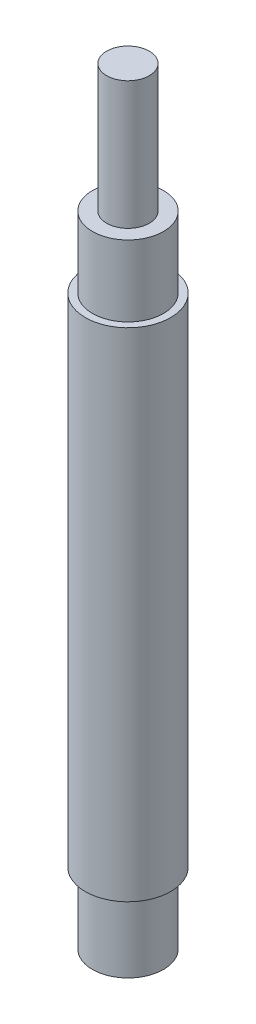
from build123d import *

# Parameters (mm, degrees)
SKETCH1_R           = 5
BOSS_EXTRUDE1_DEPTH = 10
SKETCH2_R           = 6
BOSS_EXTRUDE2_DEPTH = 70
SKETCH3_R           = 5
BOSS_EXTRUDE3_DEPTH = 10
SKETCH4_R           = 3
BOSS_EXTRUDE4_DEPTH = 18


with BuildPart() as part:
    # Sketch1 → Boss-Extrude1 (new body)
    with BuildSketch(Plane(origin=(0, 0, 0), x_dir=(1, 0, 0), z_dir=(0, 1, 0))):
        with Locations(Location((0, 0, 0), (0, 0, 270))):
            Circle(SKETCH1_R)
    extrude(amount=BOSS_EXTRUDE1_DEPTH)

    # Sketch2 → Boss-Extrude2 (add)
    with BuildSketch(Plane(origin=(0, 10, 0), x_dir=(1, 0, 0), z_dir=(0, 1, 0))):
        with Locations(Location((0, 0, 0), (0, 0, 270))):
            Circle(SKETCH2_R)
    extrude(amount=BOSS_EXTRUDE2_DEPTH)

    # Sketch3 → Boss-Extrude3 (add)
    with BuildSketch(Plane(origin=(0, 80, 0), x_dir=(1, 0, 0), z_dir=(0, 1, 0))):
        with Locations(Location((0, 0, 0), (0, 0, 270))):
            Circle(SKETCH3_R)
    extrude(amount=BOSS_EXTRUDE3_DEPTH)

    # Sketch4 → Boss-Extrude4 (add)
    with BuildSketch(Plane(origin=(0, 90, 0), x_dir=(1, 0, 0), z_dir=(0, 1, 0))):
        with Locations(Location((0, 0, 0), (0, 0, 270))):
            Circle(SKETCH4_R)
    extrude(amount=BOSS_EXTRUDE4_DEPTH)


solid = part.part
